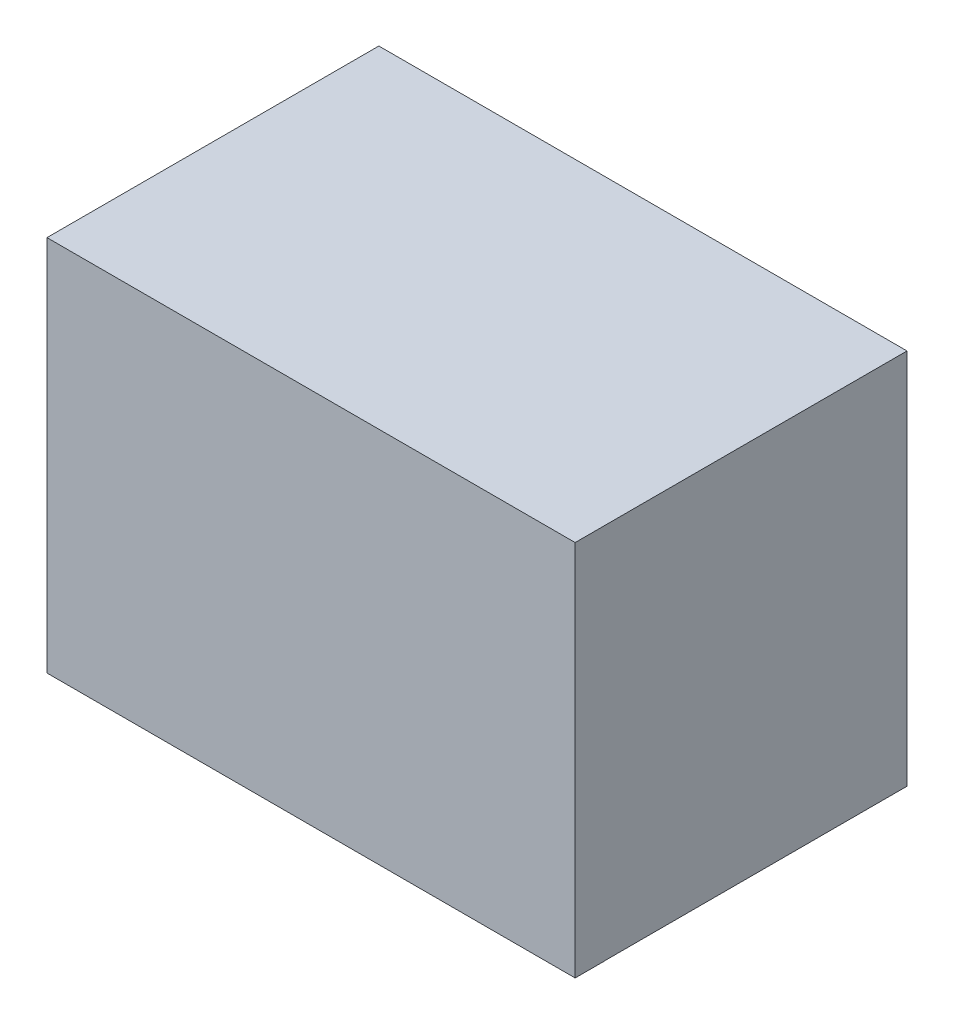
from build123d import *

# Parameters (mm, degrees)
BOSS_EXTRUDE1_DEPTH      = 50.8
BOSS_EXTRUDE1_DEPTH_BACK = 50.8
SKETCH1_W                = 177.870967952
SKETCH1_H                = 126.951722988
SKETCH3_W                = 152.508374468
SKETCH3_H                = 101.481852174
CUT_EXTRUDE1_DEPTH       = 88.9
FILLET1_R                = 12.7
CUT_EXTRUDE2_DEPTH       = 138.938
CUT_EXTRUDE2_DEPTH_BACK  = 127
SKETCH4_R                = 1.5875
CUT_EXTRUDE3_DEPTH       = 141.861333596
CUT_EXTRUDE3_DEPTH_BACK  = 36.576
SKETCH5_R                = 3.175
SKETCH6_W                = 177.870967952
SKETCH6_H                = 10.163315621
BOSS_EXTRUDE2_DEPTH      = 127


with BuildPart() as part:
    # Sketch1 → Boss-Extrude1 (new, two sides: drawn at the far end of the back side and taken through both)
    with BuildSketch(Plane.XY.offset(-BOSS_EXTRUDE1_DEPTH_BACK)):
        Rectangle(SKETCH1_W, SKETCH1_H)
    extrude(amount=BOSS_EXTRUDE1_DEPTH + BOSS_EXTRUDE1_DEPTH_BACK)

    # Sketch3 → Cut-Extrude1 (cut)
    with BuildSketch(Plane.XY.offset(50.8)):
        Rectangle(SKETCH3_W, SKETCH3_H)
    extrude(amount=-CUT_EXTRUDE1_DEPTH, mode=Mode.SUBTRACT)

    # Fillet1
    fillet1_edges = [part.edges().sort_by_distance(p)[0] for p in [
        (-76.254187234, -50.740926087, 6.35),
        (-76.254187234, 0, -38.1),
        (0, 50.740926087, -38.1),
        (76.254187234, 0, -38.1),
        (0, -50.740926087, -38.1),
        (76.254187234, -50.740926087, 6.35),
        (76.254187234, 50.740926087, 6.35),
        (-76.254187234, 50.740926087, 6.35),
    ]]
    fillet(fillet1_edges, radius=FILLET1_R)

    # Sketch4 → Cut-Extrude2 (cut, two sides: drawn at the far end of the back side and taken through both)
    with BuildSketch(Plane.XY.offset(-38.1).offset(-CUT_EXTRUDE2_DEPTH_BACK)):
        with Locations((-25.4, 0)):
            Circle(SKETCH4_R)
    extrude(amount=CUT_EXTRUDE2_DEPTH + CUT_EXTRUDE2_DEPTH_BACK, mode=Mode.SUBTRACT)

    # Sketch5 → Cut-Extrude3 (cut, two sides: drawn at the far end of the back side and taken through both)
    with BuildSketch(Plane.XY.offset(-38.1).offset(-CUT_EXTRUDE3_DEPTH_BACK)):
        with Locations((-7.62, 0)):
            Circle(SKETCH5_R)
    extrude(amount=CUT_EXTRUDE3_DEPTH + CUT_EXTRUDE3_DEPTH_BACK, mode=Mode.SUBTRACT)

    # Sketch6 → Boss-Extrude2 (add)
    with BuildSketch(Plane(origin=(0, 63.475861494, 0), x_dir=(1, 0, 0), z_dir=(0, 1, 0))):
        with Locations((0, -55.881657811)):
            Rectangle(SKETCH6_W, SKETCH6_H)
    extrude(amount=-BOSS_EXTRUDE2_DEPTH)


solid = part.part
